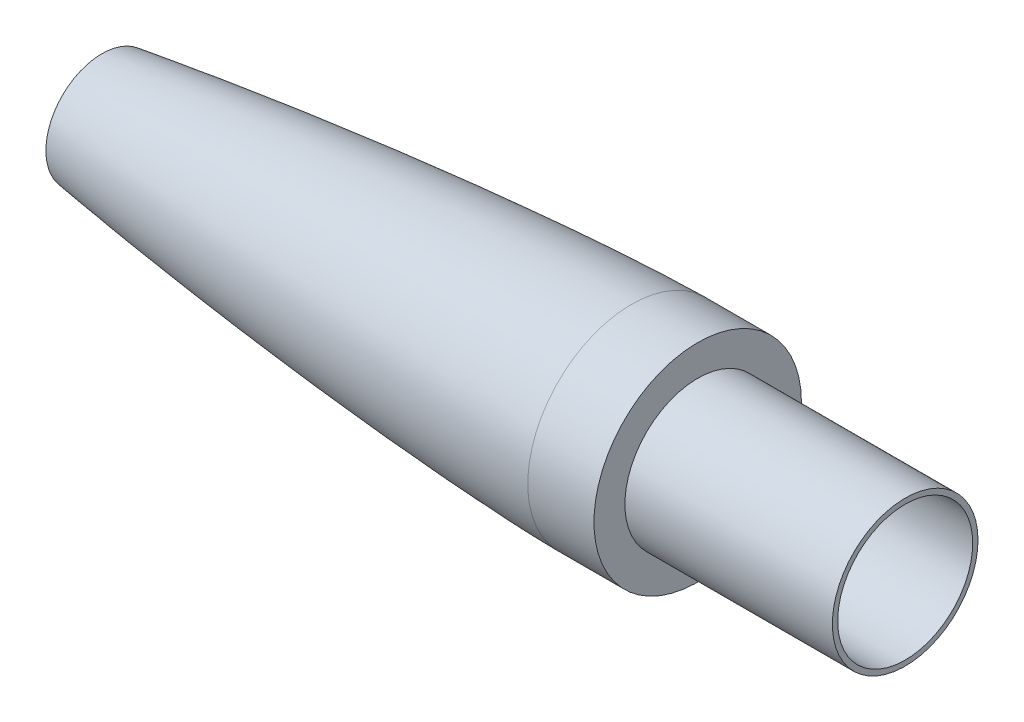
from build123d import *

# Parameters (mm, degrees)
SKETCH2_R          = 51
CUT_EXTRUDE1_DEPTH = 400
SKETCH3_R          = 33
SKETCH3_R_2        = 3.1
CUT_EXTRUDE2_DEPTH = 40
SKETCH3_2_R        = 3.1
CUT_EXTRUDE4_DEPTH = 617.757438246


with BuildPart() as part:
    # Sketch1 → Revolve1 (revolve)
    with BuildSketch(Plane.XY):
        with BuildLine():
            Line((650, 78.36), (600, 78.36))
            add(Edge.make_bspline(
                [(200, 42.32828037), (208.17052038, 43.513954023), (225.684887064, 45.995278148), (252.564625249, 49.617202919), (288.837779512, 54.154525537), (326.320734141, 58.489281574), (363.841177133, 62.486312126), (401.395994208, 66.14650922), (438.982971251, 69.460608736), (476.600652971, 72.407109383), (509.54226569, 74.628697811), (537.796481139, 76.233504653), (560.29226218, 77.275459401), (575.195356704, 77.83264328), (587.214225045, 78.173006727), (594.519976189, 78.310355882), (598.17325676, 78.35432466), (600, 78.36)],
                knots=[0.337827743, 0.337827743, 0.337827743, 0.337827743, 0.337827743, 0.392246706, 0.454423417, 0.516600127, 0.57877684, 0.640953552, 0.703130263, 0.765306975, 0.827483687, 0.889660399, 0.920748755, 0.951837111, 0.975918556, 0.987959278, 1, 1, 1, 1, 1], degree=4))
            Line((200, 42.32828037), (200, 0))
            Line((200, 0), (806.72, 0))
            Line((806.72, 0), (806.72, 55))
            Line((806.72, 55), (650, 55))
            Line((650, 55), (650, 78.36))
        make_face()
    revolve(axis=Axis((806.72, 0, 0), (-1, 0, 0)))

    # Sketch2 → Cut-Extrude1 (cut)
    with BuildSketch(Plane(origin=(806.72, 0, 0), x_dir=(0, 0, -1), z_dir=(1, 0, 0))):
        Circle(SKETCH2_R)
    extrude(amount=-CUT_EXTRUDE1_DEPTH, mode=Mode.SUBTRACT)

    # Sketch3 → Cut-Extrude2 (cut)
    with BuildSketch(Plane.ZY.offset(-200)):
        Circle(SKETCH3_R)
        with Locations((0, 20)):
            Circle(SKETCH3_R_2, mode=Mode.SUBTRACT)
        with Locations((0, -20)):
            Circle(SKETCH3_R_2, mode=Mode.SUBTRACT)
    extrude(amount=-CUT_EXTRUDE2_DEPTH, mode=Mode.SUBTRACT)

    # Sketch3<2> → Cut-Extrude4 (cut, through all)
    with BuildSketch(Plane.ZY.offset(-200)):
        with Locations((0, 20)):
            Circle(SKETCH3_2_R)
        with Locations((0, -20)):
            Circle(SKETCH3_2_R)
    extrude(amount=-CUT_EXTRUDE4_DEPTH, mode=Mode.SUBTRACT)


solid = part.part
